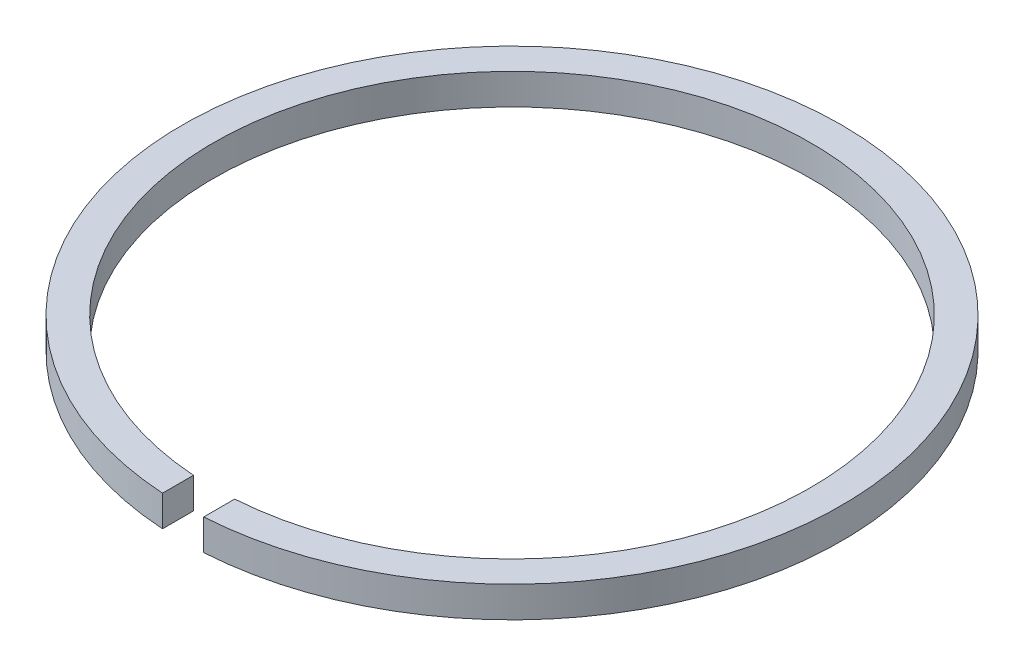
from build123d import *

# Parameters (mm, degrees)
BOSS_EXTRUDE1_DEPTH = 1.5


with BuildPart() as part:
    # Sketch1 → Boss-Extrude1 (new body)
    with BuildSketch(Plane(origin=(0, 0, 0), x_dir=(1, 0, 0), z_dir=(0, 1, 0))):
        with BuildLine():
            Line((-1, -14.465476141), (-1, -15.968719423))
            ThreePointArc((-1, -15.968719423), (0, 16), (1, -15.968719423))
            Line((1, -15.968719423), (1, -14.465476141))
            ThreePointArc((1, -14.465476141), (0, 14.5), (-1, -14.465476141))
        make_face()
    extrude(amount=BOSS_EXTRUDE1_DEPTH)


solid = part.part
